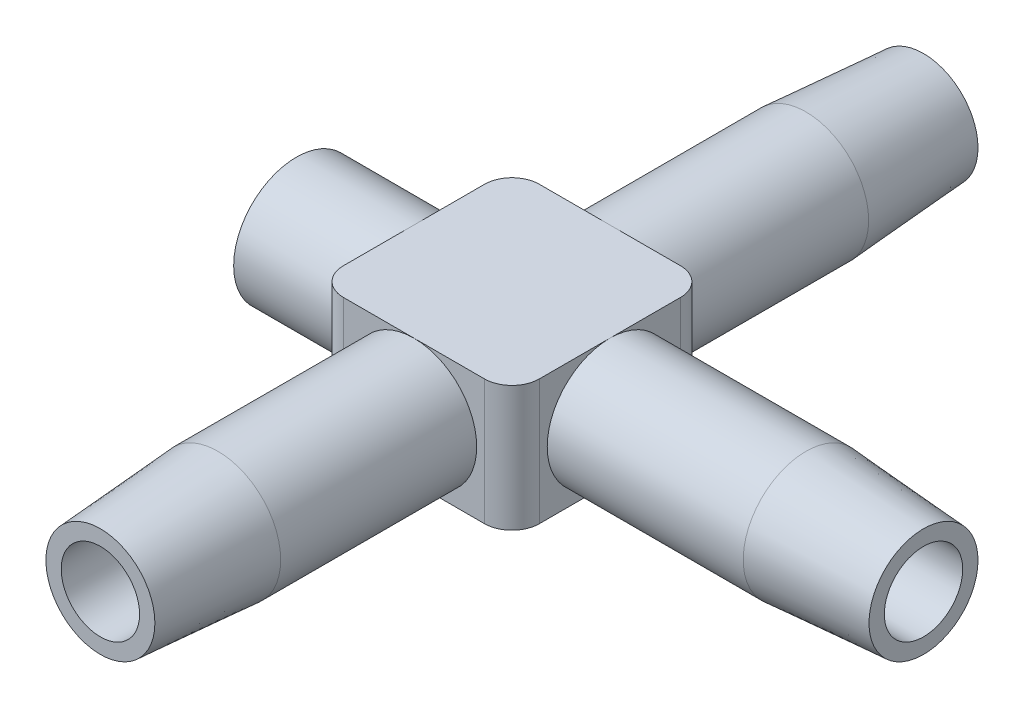
from build123d import *

# Parameters (mm, degrees)
SKETCH1_W               = 10
SKETCH1_H               = 10
BOSS_EXTRUDE1_DEPTH     = 6.4
SKETCH2_R               = 3.2
BOSS_EXTRUDE2_DEPTH     = 10
SKETCH4_R               = 3.2
BOSS_EXTRUDE3_DEPTH     = 10
SKETCH8_R               = 3.2
BOSS_EXTRUDE4_DEPTH     = 6
BOSS_EXTRUDE4_TAPER     = 4
SKETCH10_R              = 3.2
BOSS_EXTRUDE5_DEPTH     = 6
BOSS_EXTRUDE5_TAPER     = 4
FILLET1_R               = 1.4
SKETCH11_R              = 2
CUT_EXTRUDE5_DEPTH      = 48.391560488
CUT_EXTRUDE6_REACH      = 36.029
CUT_EXTRUDE6_END_RADIUS = 2
SKETCH9_R               = 2
BOSS_EXTRUDE6_START     = 6
SKETCH12_R              = 3.2
SKETCH12_R_2            = 1.8
BOSS_EXTRUDE6_DEPTH     = 6


with BuildPart() as part:
    # Sketch1 → Boss-Extrude1 (new body)
    with BuildSketch(Plane(origin=(0, 0, 0), x_dir=(1, 0, 0), z_dir=(0, 1, 0))):
        Rectangle(SKETCH1_W, SKETCH1_H)
    extrude(amount=BOSS_EXTRUDE1_DEPTH)

    # Sketch2 → Boss-Extrude2 (add)
    with BuildSketch(Plane.XY.offset(5)):
        with Locations(Location((0, 3.2, 0), (0, 0, 270))):
            Circle(SKETCH2_R)
    boss_extrude2 = extrude(amount=BOSS_EXTRUDE2_DEPTH)

    # Sketch4 → Boss-Extrude3 (add)
    with BuildSketch(Plane(origin=(5, 0, 0), x_dir=(0, 0, -1), z_dir=(1, 0, 0))):
        with Locations(Location((0, 3.2, 0), (0, 0, 270))):
            Circle(SKETCH4_R)
    extrude(amount=BOSS_EXTRUDE3_DEPTH)

    # Sketch8 → Boss-Extrude4 (add)
    with BuildSketch(Plane(origin=(15, 0, 0), x_dir=(0, 0, -1), z_dir=(1, 0, 0))):
        with Locations(Location((0, 3.2, 0), (0, 0, 270))):
            Circle(SKETCH8_R)
    extrude(amount=BOSS_EXTRUDE4_DEPTH, taper=BOSS_EXTRUDE4_TAPER)

    # Sketch10 → Boss-Extrude5 (add)
    with BuildSketch(Plane.XY.offset(15)):
        with Locations(Location((0, 3.2, 0), (0, 0, 270))):
            Circle(SKETCH10_R)
    boss_extrude5 = extrude(amount=BOSS_EXTRUDE5_DEPTH, taper=BOSS_EXTRUDE5_TAPER)

    # Mirror2: Boss-Extrude2, Boss-Extrude5 across plane
    add(boss_extrude2.mirror(Plane.XY))
    add(boss_extrude5.mirror(Plane.XY))

    # Fillet1
    fillet1_edges = [part.edges().sort_by_distance(p)[0] for p in [
        (-5, 3.2, -5),
        (5, 3.2, -5),
        (5, 3.2, 5),
        (-5, 3.2, 5),
    ]]
    fillet(fillet1_edges, radius=FILLET1_R)

    # Sketch11 → Cut-Extrude5 (cut, through all)
    with BuildSketch(Plane.XY.offset(21)):
        with Locations((0, 3.2)):
            Circle(SKETCH11_R)
    extrude(amount=-CUT_EXTRUDE5_DEPTH, mode=Mode.SUBTRACT)

    # Cut-Extrude6: up to this cylinder (the profile starts outside it)
    cut_extrude6_end = Plane(origin=(0, 3.2, 0), z_dir=(0, 0, 1)) * Cylinder(CUT_EXTRUDE6_END_RADIUS, 77.058, mode=Mode.PRIVATE)
    # Sketch9 → Cut-Extrude6 (cut, up to the surface)
    with BuildSketch(Plane(origin=(21, 0, 0), x_dir=(0, 0, -1), z_dir=(1, 0, 0)), mode=Mode.PRIVATE) as cut_extrude6_sk1:
        with Locations((0, 3.2)):
            Circle(SKETCH9_R)
    cut_extrude6_tool1 = extrude(cut_extrude6_sk1.sketch, amount=-CUT_EXTRUDE6_REACH, mode=Mode.PRIVATE) - cut_extrude6_end
    add(cut_extrude6_tool1.solids().sort_by_distance((21, 3.2, 0))[0], mode=Mode.SUBTRACT)

    # Sketch12 → Boss-Extrude6 (add)
    with BuildSketch(Plane.ZY.offset(5).offset(BOSS_EXTRUDE6_START)):
        with Locations(Location((0, 3.2, 0), (0, 0, 270))):
            Circle(SKETCH12_R)
        with Locations((0, 3.2)):
            Circle(SKETCH12_R_2, mode=Mode.SUBTRACT)
    extrude(amount=-BOSS_EXTRUDE6_DEPTH)


solid = part.part
